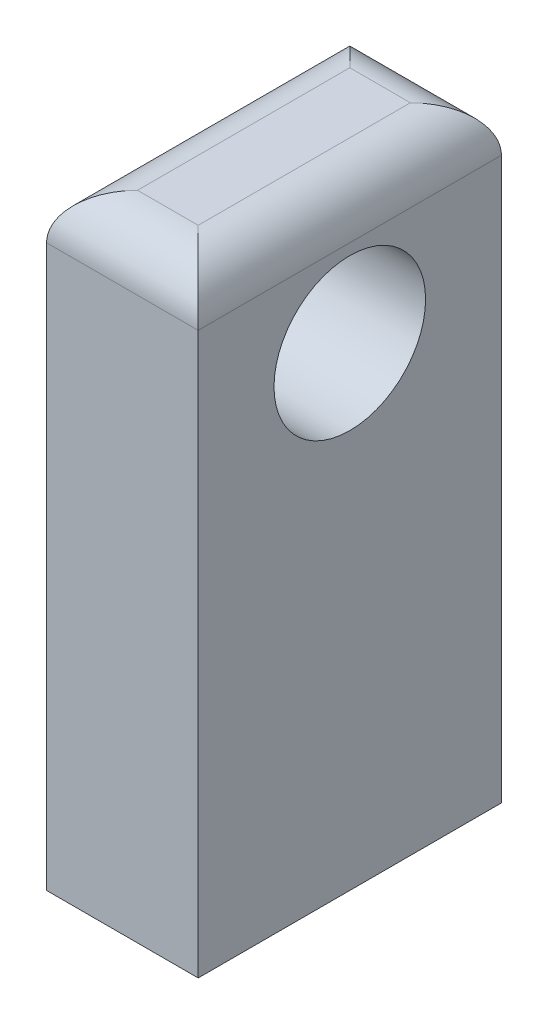
from build123d import *

# Parameters (mm, degrees)
SKETCH1_W                 = 20
SKETCH1_H                 = 40
SKETCH1_R                 = 5
BOSS_EXTRUDE1_DEPTH       = 10
FILLET1_R                 = 3
F_3_0MM_DOWEL_HOLE1_D     = 3
F_3_0MM_DOWEL_HOLE1_DEPTH = 5
F_3_0MM_DOWEL_HOLE1_TIP   = 0.901290929


with BuildPart() as part:
    # Sketch1 → Boss-Extrude1 (new body)
    with BuildSketch(Plane(origin=(0, 0, 0), x_dir=(0, 0, -1), z_dir=(1, 0, 0))):
        Rectangle(SKETCH1_W, SKETCH1_H)
        with Locations((0, 11.27)):
            Circle(SKETCH1_R, mode=Mode.SUBTRACT)
    extrude(amount=BOSS_EXTRUDE1_DEPTH)

    # Fillet1
    fillet1_edges = [part.edges().sort_by_distance(p)[0] for p in [
        (5, 20, 10),
        (5, 20, -10),
        (10, 20, 0),
        (0, 20, 0),
    ]]
    fillet(fillet1_edges, radius=FILLET1_R)

    # Ø3.0mm Dowel Hole1
    with Locations(Plane.XZ.offset(20)):
        with Locations((5, 0)):
            Hole(F_3_0MM_DOWEL_HOLE1_D / 2, depth=F_3_0MM_DOWEL_HOLE1_DEPTH)
            with Locations((0, 0, -(F_3_0MM_DOWEL_HOLE1_DEPTH + F_3_0MM_DOWEL_HOLE1_TIP / 2))):  # 118° drill point
                Cone(0, F_3_0MM_DOWEL_HOLE1_D / 2, F_3_0MM_DOWEL_HOLE1_TIP, mode=Mode.SUBTRACT)


solid = part.part
